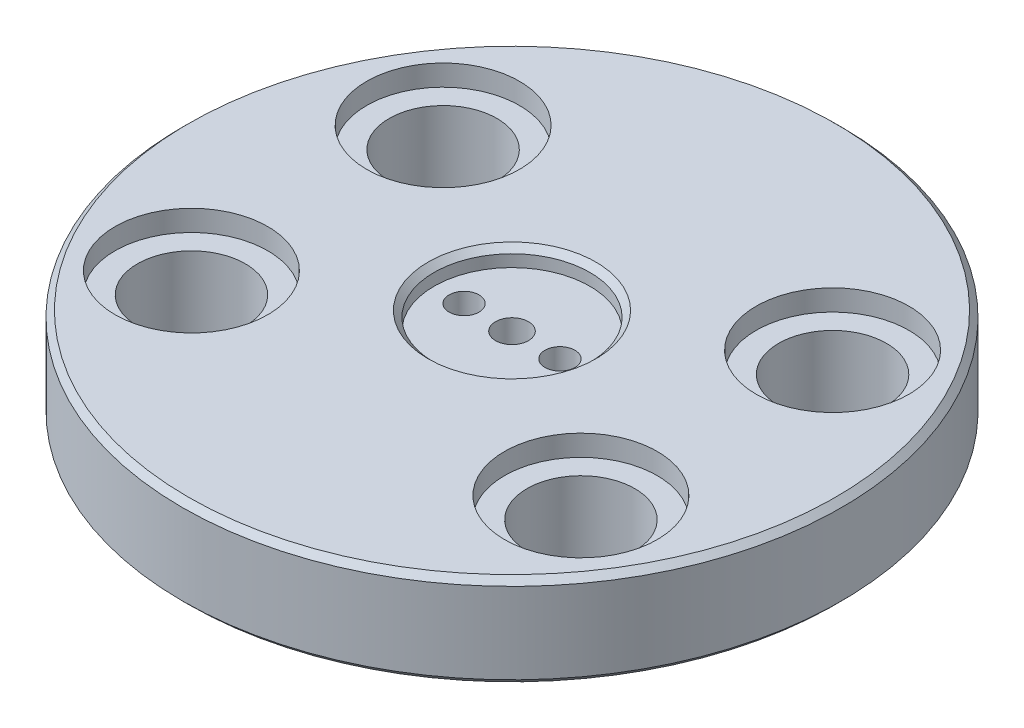
from build123d import *

# Parameters (mm, degrees)
SKETCH1_R                                           = 55
BOSS_EXTRUDE1_DEPTH                                 = 15.5
CBORE_FOR_M6_HEX_SOCKET_HEAD_CAP_SCREW1_D           = 18
CBORE_FOR_M6_HEX_SOCKET_HEAD_CAP_SCREW1_CBORE_D     = 25.5
CBORE_FOR_M6_HEX_SOCKET_HEAD_CAP_SCREW1_CBORE_DEPTH = 3.5
SKETCH5_R                                           = 13
CUT_EXTRUDE1_DEPTH                                  = 3
F_5_0MM_DOWEL_HOLE1_D                               = 5
CHAMFER1_SIZE                                       = 1
CHAMFER2_SIZE                                       = 1
CBORE_FOR_M5_HEX_SOCKET_HEAD_CAP_SCREW1_D           = 5.5
CBORE_FOR_M5_HEX_SOCKET_HEAD_CAP_SCREW1_CBORE_D     = 9
CBORE_FOR_M5_HEX_SOCKET_HEAD_CAP_SCREW1_CBORE_DEPTH = 6


with BuildPart() as part:
    # Sketch1 → Boss-Extrude1 (new body)
    with BuildSketch(Plane(origin=(0, 0, 0), x_dir=(1, 0, 0), z_dir=(0, 1, 0))):
        with Locations(Location((0, 0, 0), (0, 0, 270))):
            Circle(SKETCH1_R)
    extrude(amount=BOSS_EXTRUDE1_DEPTH)

    # CBORE for M6 Hex Socket Head Cap Screw1 (through all)
    with Locations(Plane(origin=(0, 15.5, 0), x_dir=(1, 0, 0), z_dir=(0, 1, 0))):
        with Locations((-32.5, 21), (32.5, 21), (32.5, -21), (-32.5, -21)):
            CounterBoreHole(CBORE_FOR_M6_HEX_SOCKET_HEAD_CAP_SCREW1_D / 2, CBORE_FOR_M6_HEX_SOCKET_HEAD_CAP_SCREW1_CBORE_D / 2, CBORE_FOR_M6_HEX_SOCKET_HEAD_CAP_SCREW1_CBORE_DEPTH)

    # Sketch5 → Cut-Extrude1 (cut)
    with BuildSketch(Plane(origin=(0, 15.5, 0), x_dir=(1, 0, 0), z_dir=(0, 1, 0))):
        with Locations(Location((0, 0, 0), (0, 0, 270))):
            Circle(SKETCH5_R)
    extrude(amount=-CUT_EXTRUDE1_DEPTH, mode=Mode.SUBTRACT)

    # Ø5.0mm Dowel Hole1 (through all)
    with Locations(Plane(origin=(0, 12.5, 0), x_dir=(1, 0, 0), z_dir=(0, 1, 0))):
        with Locations((-8, 0), (8, 0)):
            Hole(F_5_0MM_DOWEL_HOLE1_D / 2)

    # Chamfer1
    chamfer1_edges = [part.edges().sort_by_distance(p)[0] for p in [
        (0, 15.5, -13),
        (0, 15.5, -55),
    ]]
    chamfer(chamfer1_edges, length=CHAMFER1_SIZE)

    # Chamfer2
    chamfer2_edges = [part.edges().sort_by_distance(p)[0] for p in [
        (0, 0, -55),
    ]]
    chamfer(chamfer2_edges, length=CHAMFER2_SIZE)

    # CBORE for M5 Hex Socket Head Cap Screw1 (through all)
    with Locations(Plane(origin=(0, 0, 0), x_dir=(-1, 0, 0), z_dir=(0, -1, 0))):
        with Locations((0, 0)):
            CounterBoreHole(CBORE_FOR_M5_HEX_SOCKET_HEAD_CAP_SCREW1_D / 2, CBORE_FOR_M5_HEX_SOCKET_HEAD_CAP_SCREW1_CBORE_D / 2, CBORE_FOR_M5_HEX_SOCKET_HEAD_CAP_SCREW1_CBORE_DEPTH)


solid = part.part
